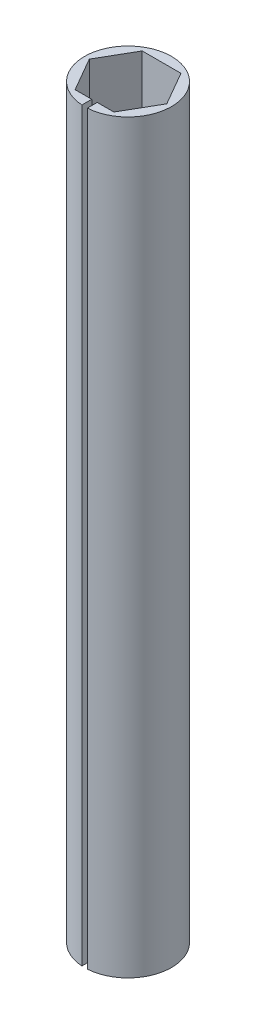
from build123d import *

# Parameters (mm, degrees)
SKETCH1_R           = 8.89
BOSS_EXTRUDE1_DEPTH = 152.4
SKETCH2_W           = 1.113251556
SKETCH2_H           = 8.614313674
CUT_EXTRUDE1_DEPTH  = 153.917704011


with BuildPart() as part:
    # Sketch1 → Boss-Extrude1 (new body)
    with BuildSketch(Plane(origin=(0, 0, 0), x_dir=(1, 0, 0), z_dir=(0, 1, 0))):
        with Locations(Location((0, 0, 0), (0, 0, 90))):
            Circle(SKETCH1_R)
        Polygon((3.959468146, -6.858), (7.918936292, 0), (3.959468146, 6.858), (-3.959468146, 6.858), (-7.918936292, 0), (-3.959468146, -6.858), align=None, mode=Mode.SUBTRACT)
    extrude(amount=BOSS_EXTRUDE1_DEPTH)

    # Sketch2 → Cut-Extrude1 (cut, through all)
    with BuildSketch(Plane(origin=(0, 0, 0), x_dir=(-1, 0, 0), z_dir=(0, -1, 0))):
        with Locations((0, -8.353945441)):
            Rectangle(SKETCH2_W, SKETCH2_H)
    extrude(amount=-CUT_EXTRUDE1_DEPTH, mode=Mode.SUBTRACT)


solid = part.part
